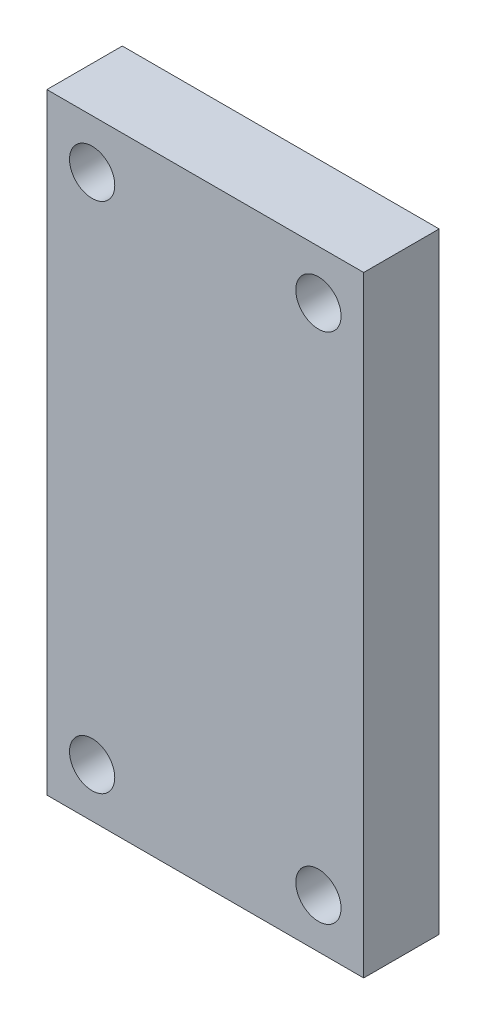
from build123d import *

# Parameters (mm, degrees)
SKIZZE1_W                       = 21
SKIZZE1_H                       = 40.5
AUFSATZ_LINEAR_AUSTRAGEN1_DEPTH = 5
SKIZZE2_R                       = 1.5
SCHNITT_LINEAR_AUSTRAGEN1_DEPTH = 24.351927115


with BuildPart() as part:
    # Skizze1 → Aufsatz-Linear austragen1 (new body)
    with BuildSketch(Plane.XY):
        Rectangle(SKIZZE1_W, SKIZZE1_H)
    extrude(amount=AUFSATZ_LINEAR_AUSTRAGEN1_DEPTH)

    # Skizze2 → Schnitt-Linear austragen1 (cut, through all)
    with BuildSketch(Plane.XY.offset(5)):
        with Locations((-7.5, 17)):
            Circle(SKIZZE2_R)
        with Locations((7.5, 17)):
            Circle(SKIZZE2_R)
        with Locations((-7.5, -17)):
            Circle(SKIZZE2_R)
        with Locations((7.5, -17)):
            Circle(SKIZZE2_R)
    extrude(amount=-SCHNITT_LINEAR_AUSTRAGEN1_DEPTH, mode=Mode.SUBTRACT)


solid = part.part
